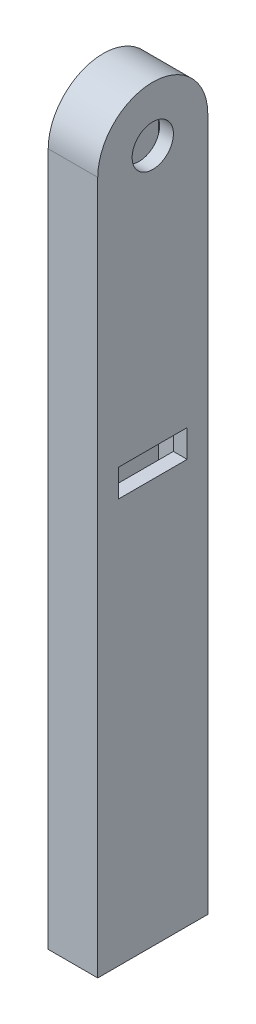
from build123d import *

# Parameters (mm, degrees)
BOSS_EXTRUDE1_START = -9
SKETCH2_R           = 7.5
BOSS_EXTRUDE1_DEPTH = 5
BOSS_EXTRUDE2_START = -4
BOSS_EXTRUDE2_DEPTH = 4
CUT_EXTRUDE1_START  = 4
SKETCH4_W           = 25
SKETCH4_H           = 10
CUT_EXTRUDE1_DEPTH  = 5


with BuildPart() as part:
    # Sketch2 → Boss-Extrude1 (new body)
    with BuildSketch(Plane(origin=(0, 0, 0), x_dir=(0, 0, -1), z_dir=(1, 0, 0)).offset(BOSS_EXTRUDE1_START)):
        with BuildLine():
            Line((-20, 0), (-20, -252))
            Line((-20, -252), (20, -252))
            Line((20, -252), (20, 0))
            ThreePointArc((20, 0), (0, 20), (-20, 0))
        make_face()
        Circle(SKETCH2_R, mode=Mode.SUBTRACT)
    extrude(amount=BOSS_EXTRUDE1_DEPTH)

    # Sketch2<6> → Boss-Extrude2 (add)
    with BuildSketch(Plane(origin=(0, 0, 0), x_dir=(0, 0, -1), z_dir=(1, 0, 0)).offset(BOSS_EXTRUDE2_START)):
        with BuildLine():
            Line((-20, 0), (-20, -252))
            Line((-20, -252), (20, -252))
            Line((20, -252), (20, 0))
            ThreePointArc((20, 0), (0, 20), (-20, 0))
        make_face()
        with BuildLine():
            Line((-15, 0), (-15, -247))
            Line((-15, -247), (15, -247))
            Line((15, -247), (15, 0))
            ThreePointArc((15, 0), (0, 15), (-15, 0))
        make_face(mode=Mode.SUBTRACT)
    extrude(amount=BOSS_EXTRUDE2_DEPTH)

    # Mirror1: part across plane


with BuildPart() as part_1:
    add(part.part)
    add(part.part.mirror(Plane(origin=(0, 0, 0), x_dir=(0, 0, 1), z_dir=(1, 0, 0))))

    # Sketch4 → Cut-Extrude1 (cut)
    with BuildSketch(Plane(origin=(0, 0, 0), x_dir=(0, 0, -1), z_dir=(1, 0, 0)).offset(CUT_EXTRUDE1_START)):
        with Locations((0, -100)):
            Rectangle(SKETCH4_W, SKETCH4_H)
    extrude(amount=CUT_EXTRUDE1_DEPTH, mode=Mode.SUBTRACT)


solid = part_1.part
